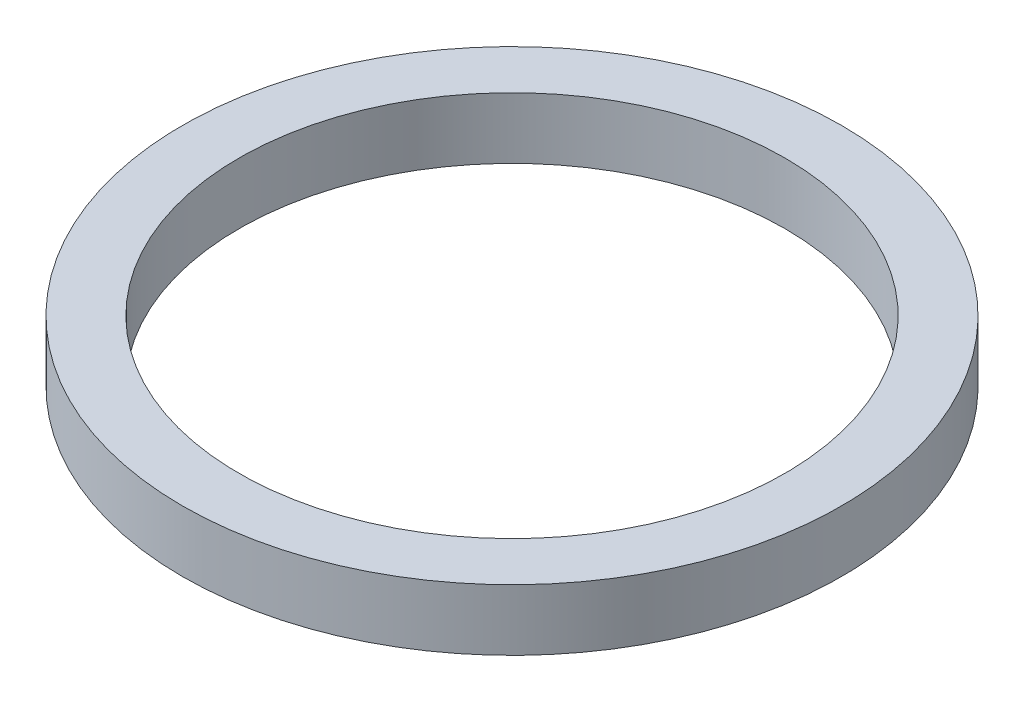
from build123d import *

# Parameters (mm, degrees)
CROQUIS1_R              = 35
CROQUIS1_R_2            = 29
SALIENTE_EXTRUIR1_DEPTH = 6.5


with BuildPart() as part:
    # Croquis1 → Saliente-Extruir1 (new body)
    with BuildSketch(Plane(origin=(0, 0, 0), x_dir=(1, 0, 0), z_dir=(0, 1, 0))):
        with Locations(Location((0, 0, 0), (0, 0, 90))):
            Circle(CROQUIS1_R)
        with Locations(Location((0, 0, 0), (0, 0, 90))):
            Circle(CROQUIS1_R_2, mode=Mode.SUBTRACT)
    extrude(amount=SALIENTE_EXTRUIR1_DEPTH)


solid = part.part
